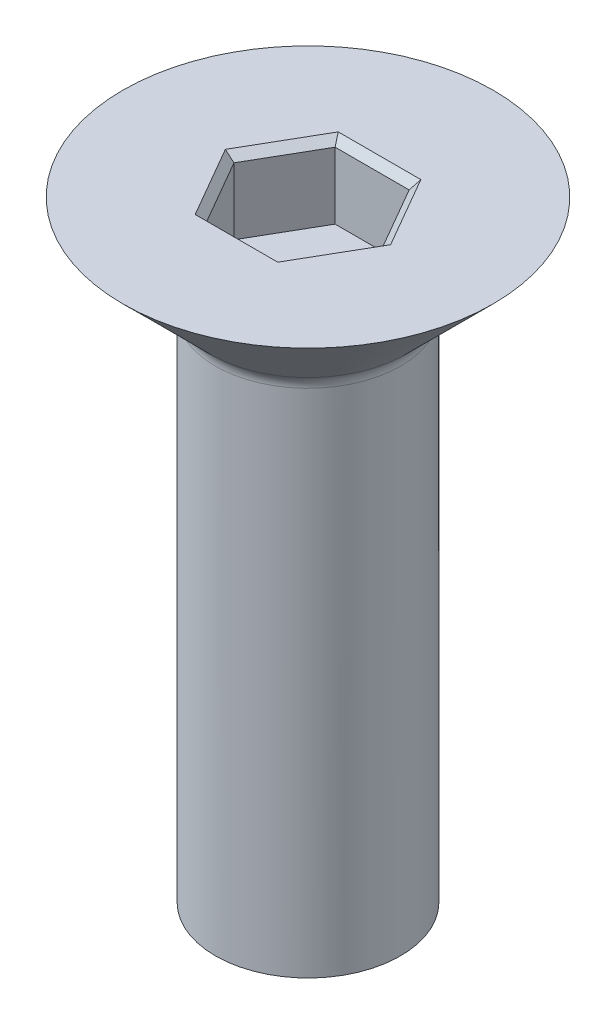
from build123d import *

# Parameters (mm, degrees)
SKETCH1_R           = 2.5
BOSS_EXTRUDE1_DEPTH = 14
CUT_EXTRUDE1_DEPTH  = 2
CHAMFER1_SIZE       = 0.2
FILLET1_R           = 0.5


with BuildPart() as part:
    # Sketch1 → Boss-Extrude1 (new body)
    with BuildSketch(Plane(origin=(0, 0, 0), x_dir=(1, 0, 0), z_dir=(0, 1, 0))):
        with Locations(Location((0, 0, 0), (0, 0, 270))):
            Circle(SKETCH1_R)
    extrude(amount=BOSS_EXTRUDE1_DEPTH)

    # Sketch2 → Revolve1 (revolve)
    with BuildSketch(Plane.XY, mode=Mode.PRIVATE) as revolve1_sk:
        Polygon((-5, 16.5), (-2.5, 14), (0, 14), (0, 16.5), align=None)
    revolve(revolve1_sk.sketch.rotate(Axis((0, 14, 0), (0, 1, 0)), 90), axis=Axis((0, 14, 0), (0, 1, 0)))

    # Sketch3 → Cut-Extrude1 (cut)
    with BuildSketch(Plane(origin=(0, 16.5, 0), x_dir=(1, 0, 0), z_dir=(0, 1, 0))):
        Polygon((2, 0), (1, 1.732050808), (-1, 1.732050808), (-2, 0), (-1, -1.732050808), (1, -1.732050808), align=None)
    extrude(amount=-CUT_EXTRUDE1_DEPTH, mode=Mode.SUBTRACT)

    # Chamfer1
    chamfer1_edges = [part.edges().sort_by_distance(p)[0] for p in [
        (1.5, 16.5, 0.866025404),
        (1.5, 16.5, -0.866025404),
        (0, 16.5, -1.732050808),
        (-1.5, 16.5, -0.866025404),
        (-1.5, 16.5, 0.866025404),
        (0, 16.5, 1.732050808),
    ]]
    chamfer(chamfer1_edges, length=CHAMFER1_SIZE)

    # Fillet1
    fillet1_edges = [part.edges().sort_by_distance(p)[0] for p in [
        (0, 14, -2.5),
    ]]
    fillet(fillet1_edges, radius=FILLET1_R)


solid = part.part
